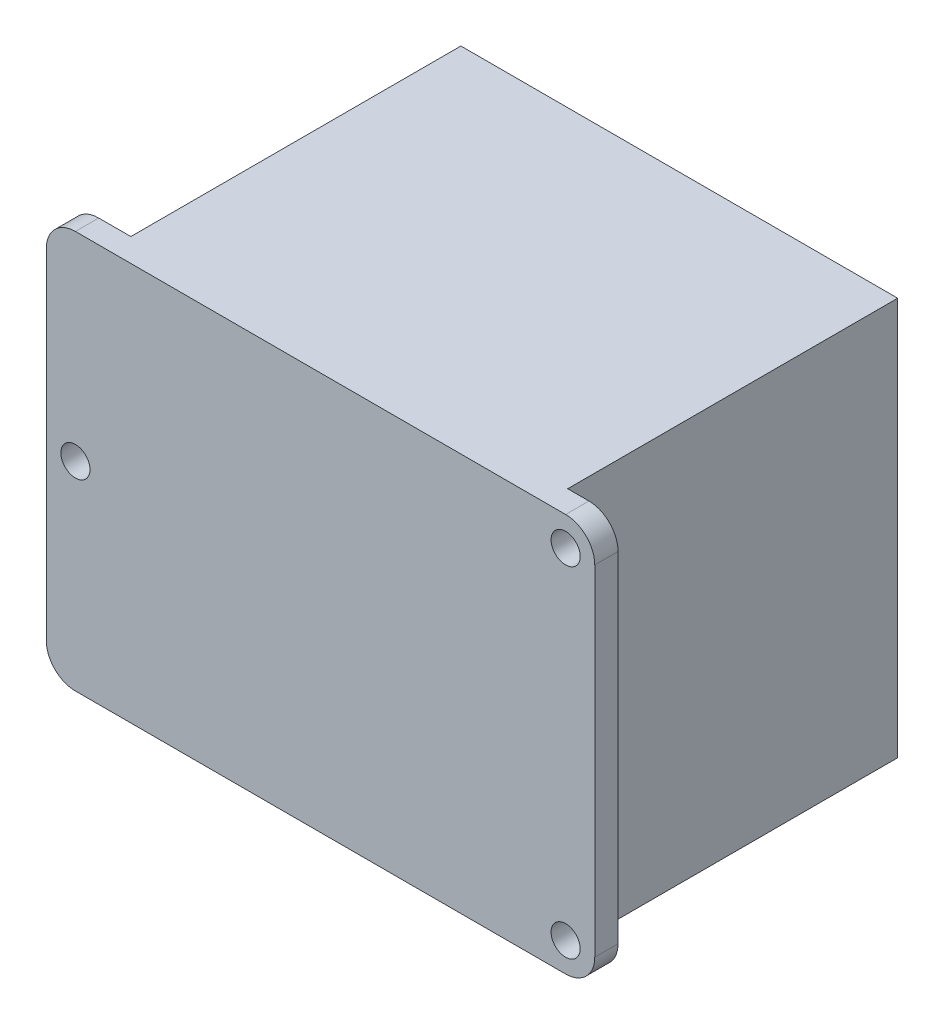
from build123d import *

# Parameters (mm, degrees)
SKETCH_1_W               = 56.5
SKETCH_1_H               = 41
EXTRUDE_1_DEPTH          = 2.4
CUT_EXTRUDE_1_DEPTH      = 70.849910522
CUT_EXTRUDE_1_DEPTH_BACK = 70.849910522
SKETCH_2_R               = 1.5
SKETCH_3_W               = 45
SKETCH_3_H               = 41
EXTRUDE_2_DEPTH          = 34
FILLET_1_R               = 3


with BuildPart() as part:
    # 草图1 → 凸台-拉伸1 (new body)
    with BuildSketch(Plane.XY):
        with Locations((28.25, -20.5)):
            Rectangle(SKETCH_1_W, SKETCH_1_H)
    extrude(amount=EXTRUDE_1_DEPTH)

    # 草图2 → 切除-拉伸1 (cut, two sides: drawn at the far end of the back side and taken through both)
    with BuildSketch(Plane.XY.offset(2.4).offset(-CUT_EXTRUDE_1_DEPTH_BACK)):
        with Locations((53.5, -3)):
            Circle(SKETCH_2_R)
        with Locations((53.5, -38)):
            Circle(SKETCH_2_R)
        with Locations((3, -20.5)):
            Circle(SKETCH_2_R)
    extrude(amount=CUT_EXTRUDE_1_DEPTH + CUT_EXTRUDE_1_DEPTH_BACK, mode=Mode.SUBTRACT)

    # 草图3 → 凸台-拉伸2 (add)
    with BuildSketch(Plane(origin=(0, 0, 0), x_dir=(-1, 0, 0), z_dir=(0, 0, -1))):
        with Locations((-28.809280121, -20.5)):
            Rectangle(SKETCH_3_W, SKETCH_3_H)
    extrude(amount=EXTRUDE_2_DEPTH)

    # 圆角1
    fillet_1_edges = [part.edges().sort_by_distance(p)[0] for p in [
        (0, 0, 1.2),
        (56.5, 0, 1.2),
        (56.5, -41, 1.2),
        (0, -41, 1.2),
    ]]
    fillet(fillet_1_edges, radius=FILLET_1_R)


solid = part.part
